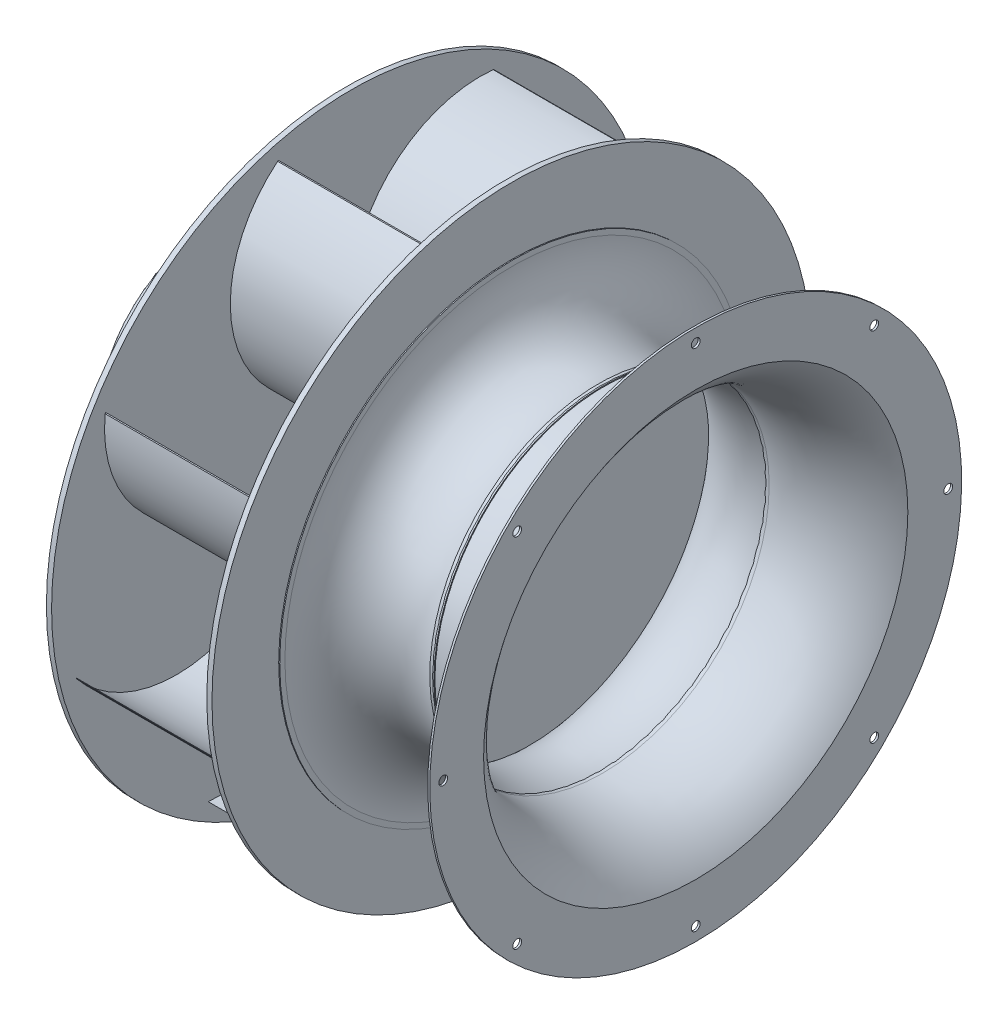
from build123d import *

# Parameters (mm, degrees)
SKETCH2_R         = 289.5
EXTRUDE1_DEPTH    = 5
SKETCH9_R         = 284.5
SKETCH9_R_2       = 100
EXTRUDE7_DEPTH    = 3
SKETCH3_R         = 289.5
EXTRUDE2_DEPTH    = 5
EXTRUDE3_DEPTH    = 155
CIRPATTERN1_COUNT = 8
SKETCH7_R         = 4.25
EXTRUDE5_DEPTH    = 5
CIRPATTERN2_COUNT = 8
SKETCH8_R         = 5
EXTRUDE6_DEPTH    = 90
CIRPATTERN3_COUNT = 8


with BuildPart() as part:
    # Sketch1 → Revolve1 (revolve)
    with BuildSketch(Plane.XY, mode=Mode.PRIVATE) as revolve1_sk:
        with BuildLine():
            Line((0, 0), (0, 109))
            ThreePointArc((0, 109), (1.464466094, 112.535533906), (5, 114))
            Line((5, 114), (70, 114))
            Line((70, 114), (70, 138))
            Line((70, 138), (90, 138))
            Line((90, 138), (90, 98))
            Line((90, 98), (95, 98))
            Line((95, 98), (95, 133))
            Line((95, 133), (105, 133))
            Line((105, 133), (105, 98))
            Line((105, 98), (129, 98))
            Line((129, 98), (129, 0))
            Line((129, 0), (0, 0))
        make_face()
    revolve(revolve1_sk.sketch.rotate(Axis((0, 0, 0), (1, 0, 0)), 90), axis=Axis((0, 0, 0), (1, 0, 0)))

    # Sketch2 → Extrude1 (add)
    with BuildSketch(Plane(origin=(129, 0, 0), x_dir=(0, 0, -1), z_dir=(1, 0, 0))):
        Circle(SKETCH2_R)
    extrude(amount=EXTRUDE1_DEPTH)

    # Sketch9 → Extrude7 (cut)
    with BuildSketch(Plane.ZY.offset(-129)):
        Circle(SKETCH9_R)
        Circle(SKETCH9_R_2, mode=Mode.SUBTRACT)
    extrude(amount=-EXTRUDE7_DEPTH, mode=Mode.SUBTRACT)



with BuildPart() as body_2:
    # Sketch3 → Extrude2 (new body)
    with BuildSketch(Plane(origin=(284, 0, 0), x_dir=(0, 0, -1), z_dir=(1, 0, 0))):
        Circle(SKETCH3_R)
    extrude(amount=EXTRUDE2_DEPTH)


with BuildPart() as part_1:
    add(part.part)

    add(body_2.part)  # Extrude3 merges body 2
    # Sketch4 → Extrude3 (add)
    with BuildSketch(Plane(origin=(134, 0, 0), x_dir=(0, 0, -1), z_dir=(1, 0, 0))):
        with BuildLine():
            Line((0, 112.5), (0.866025404, 112))
            ThreePointArc((0.866025404, 112), (41.61311066, 205.167188653), (138.116025404, 237.223973339))
            Line((138.116025404, 237.223973339), (137.25, 237.723973339))
            ThreePointArc((137.25, 237.723973339), (40.747085256, 205.667188653), (0, 112.5))
        make_face()
    extrude3 = extrude(amount=EXTRUDE3_DEPTH)

    # CirPattern1: Extrude3 ×8 about axis
    cirpattern1_axis = Axis((0, 0, 0), (1, 0, 0))
    for i in range(1, CIRPATTERN1_COUNT):
        add(extrude3.rotate(cirpattern1_axis, i * 360 / CIRPATTERN1_COUNT))

    # Sketch5 → Revolve2 (revolve)
    with BuildSketch(Plane.XY, mode=Mode.PRIVATE) as revolve2_sk:
        with BuildLine():
            Line((289, 225), (290, 225))
            Line((290, 225), (290, 220))
            ThreePointArc((290, 220), (317.71377132, 166.407354932), (378, 164))
            Line((378, 164), (378, 163))
            ThreePointArc((378, 163), (316.466342394, 164.903587247), (289, 220))
            Line((289, 220), (289, 225))
        make_face()
    revolve(revolve2_sk.sketch.rotate(Axis((0, 0, 0), (1, 0, 0)), 90), axis=Axis((0, 0, 0), (1, 0, 0)))

    # Sketch8 → Extrude6 (cut)
    with BuildSketch(Plane(origin=(0, 0, 0), x_dir=(0, 0, -1), z_dir=(1, 0, 0))):
        with Locations(Location((0, 126, 0), (0, 0, 180))):
            Circle(SKETCH8_R)
    extrude6 = extrude(amount=EXTRUDE6_DEPTH, mode=Mode.SUBTRACT)

    # CirPattern3: Extrude6 ×8 about axis
    cirpattern3_axis = Axis((0, 0, 0), (1, 0, 0))
    for i in range(1, CIRPATTERN3_COUNT):
        add(extrude6.rotate(cirpattern3_axis, i * 360 / CIRPATTERN3_COUNT), mode=Mode.SUBTRACT)


with BuildPart() as body_2_2:
    # Sketch6 → Revolve3 (revolve)
    with BuildSketch(Plane.XY, mode=Mode.PRIVATE) as revolve3_sk:
        with BuildLine():
            Line((467, 257), (465, 257))
            Line((465, 257), (465, 205))
            ThreePointArc((465, 205), (426.466047496, 172.547329056), (377, 163))
            Line((377, 163), (373, 163))
            Line((373, 163), (373, 161))
            Line((373, 161), (377, 161))
            ThreePointArc((377, 161), (427.907128888, 170.917236366), (467, 205))
            Line((467, 205), (467, 257))
        make_face()
    revolve(revolve3_sk.sketch.rotate(Axis((0, 0, 0), (1, 0, 0)), 180), axis=Axis((0, 0, 0), (1, 0, 0)))

    # Sketch7 → Extrude5 (cut)
    with BuildSketch(Plane(origin=(467, 0, 0), x_dir=(0, 0, -1), z_dir=(1, 0, 0))):
        with Locations((0, 244)):
            Circle(SKETCH7_R)
    extrude5 = extrude(amount=-EXTRUDE5_DEPTH, mode=Mode.SUBTRACT)

    # CirPattern2: Extrude5 ×8 about axis
    cirpattern2_axis = Axis((0, 0, 0), (1, 0, 0))
    for i in range(1, CIRPATTERN2_COUNT):
        add(extrude5.rotate(cirpattern2_axis, i * 360 / CIRPATTERN2_COUNT), mode=Mode.SUBTRACT)


solid = Compound([part_1.part, body_2_2.part])
